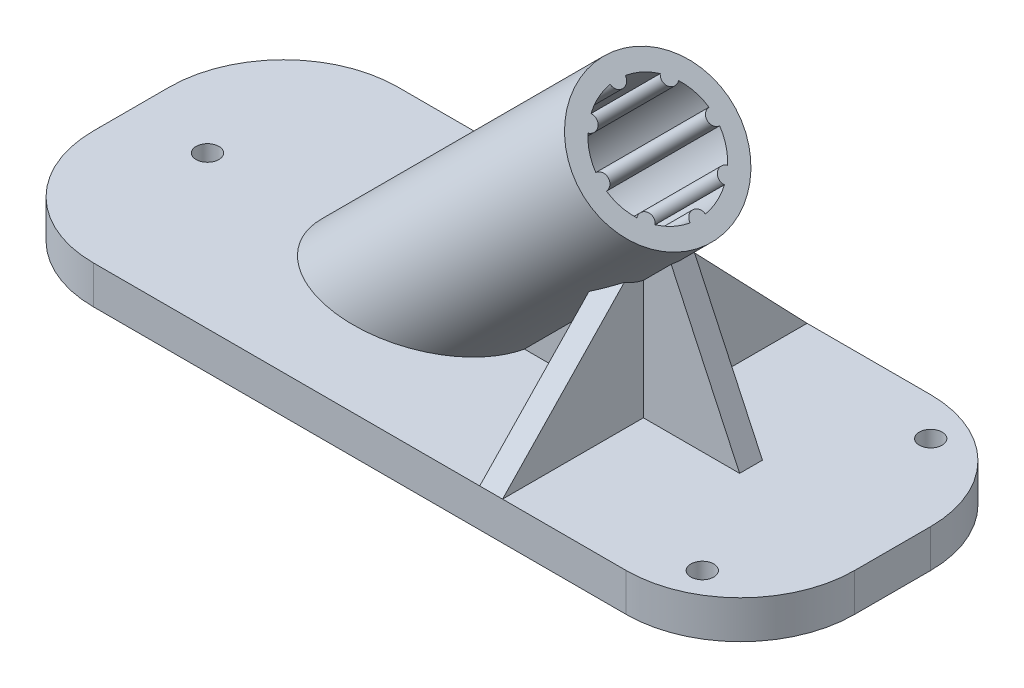
from build123d import *
from build123d.topology import SkipClean

# Parameters (mm, degrees)
BOSS_EXTRUDE1_DEPTH = 5
SKETCH3_W           = 36.405926788
SKETCH3_H           = 27.783470444
CUT_EXTRUDE1_DEPTH  = 36
CUT_EXTRUDE2_REACH  = 86.1
SKETCH4_R           = 7.5
BOSS_EXTRUDE2_REACH = 86.1
SKETCH5_R           = 1
RIB2_REACH          = 70.337
SKETCH6_WALL_W      = 155.225095754
SKETCH6_WALL_H      = 3
RIB3_REACH          = 83.817
SKETCH7_WALL_W      = 192.357197592
SKETCH7_WALL_H      = 3
RIB4_REACH          = 83.817
SKETCH9_WALL_W      = 192.357197592
SKETCH9_WALL_H      = 3
SKETCH10_R          = 1.5
CUT_EXTRUDE3_DEPTH  = 5


with BuildPart() as part:
    # Sketch1 → Boss-Extrude1 (new body)
    with BuildSketch(Plane(origin=(0, 0, 0), x_dir=(1, 0, 0), z_dir=(0, 1, 0))):
        with BuildLine():
            Line((35, 20), (-35, 20))
            ThreePointArc((-35, 20), (-45.606601718, 15.606601718), (-50, 5))
            Line((-50, 5), (-50, -5))
            ThreePointArc((-50, -5), (-45.606601718, -15.606601718), (-35, -20))
            Line((-35, -20), (35, -20))
            ThreePointArc((35, -20), (45.606601718, -15.606601718), (50, -5))
            Line((50, -5), (50, 5))
            ThreePointArc((50, 5), (45.606601718, 15.606601718), (35, 20))
        make_face()
    extrude(amount=BOSS_EXTRUDE1_DEPTH)

    # Sketch2 → Revolve2 (revolve)
    with SkipClean():  # the faces are left unmerged after this step: merging them gives an invalid solid
        with BuildSketch(Plane.XY, mode=Mode.PRIVATE) as revolve2_sk:
            Polygon((-30, 0), (12.071067812, 42.071067812), (19.142135624, 35), (-15.857864376, 0), align=None)
        revolve(revolve2_sk.sketch.rotate(Axis((19.142135624, 35, 0), (-0.7071067811865515, -0.7071067811865436, 0)), 180), axis=Axis((19.142135624, 35, 0), (-0.7071067811865515, -0.7071067811865436, 0)))

    # Sketch3 → Cut-Extrude1 (cut)
    with BuildSketch(Plane.XZ):
        with Locations((-14.157860418, 0)):
            Rectangle(SKETCH3_W, SKETCH3_H)
    extrude(amount=CUT_EXTRUDE1_DEPTH, mode=Mode.SUBTRACT)

    # Cut-Extrude2: up to this plane
    cut_extrude2_end = Plane(origin=(-35, 5, -5), z_dir=(0, 1, 0))
    # Sketch4 → Cut-Extrude2 (cut, up to the surface)
    with BuildSketch(Plane(origin=(27.071067812, 27.071067812, 0), x_dir=(0, 0, -1), z_dir=(0.7071067811865513, 0.7071067811865438, 0)), mode=Mode.PRIVATE) as cut_extrude2_sk1:
        with Locations(Location((0, 11.213203436, 0), (0, 0, 90))):
            Circle(SKETCH4_R)
    cut_extrude2_tool1 = split(extrude(cut_extrude2_sk1.sketch, amount=-CUT_EXTRUDE2_REACH, mode=Mode.PRIVATE), bisect_by=cut_extrude2_end, keep=Keep.BOTH, mode=Mode.PRIVATE)
    add(cut_extrude2_tool1.solids().sort_by_distance((19.142136, 35, 0))[0], mode=Mode.SUBTRACT)

    # Boss-Extrude2: up to this plane
    boss_extrude2_end = Plane(origin=(-35, 5, -5), z_dir=(0, 1, 0))
    # Sketch5 → Boss-Extrude2 (add, up to the surface)
    with BuildSketch(Plane(origin=(27.071067812, 27.071067812, 0), x_dir=(0, 0, -1), z_dir=(0.7071067811865513, 0.7071067811865438, 0)), mode=Mode.PRIVATE) as boss_extrude2_sk1:
        with Locations((7.5, 11.213203436)):
            Circle(SKETCH5_R)
    boss_extrude2_tool1 = split(extrude(boss_extrude2_sk1.sketch, amount=-BOSS_EXTRUDE2_REACH, mode=Mode.PRIVATE), bisect_by=boss_extrude2_end, keep=Keep.BOTH, mode=Mode.PRIVATE)
    add(boss_extrude2_tool1.solids().sort_by_distance((19.142136, 35, -7.5))[0])
    # Sketch5 → Boss-Extrude2 (add, up to the surface)
    with BuildSketch(Plane(origin=(27.071067812, 27.071067812, 0), x_dir=(0, 0, -1), z_dir=(0.7071067811865513, 0.7071067811865438, 0)), mode=Mode.PRIVATE) as boss_extrude2_sk2:
        with Locations((5.303300859, 5.909902577)):
            Circle(SKETCH5_R)
    boss_extrude2_tool2 = split(extrude(boss_extrude2_sk2.sketch, amount=-BOSS_EXTRUDE2_REACH, mode=Mode.PRIVATE), bisect_by=boss_extrude2_end, keep=Keep.BOTH, mode=Mode.PRIVATE)
    add(boss_extrude2_tool2.solids().sort_by_distance((22.892136, 31.25, -5.303301))[0])
    # Sketch5 → Boss-Extrude2 (add, up to the surface)
    with BuildSketch(Plane(origin=(27.071067812, 27.071067812, 0), x_dir=(0, 0, -1), z_dir=(0.7071067811865513, 0.7071067811865438, 0)), mode=Mode.PRIVATE) as boss_extrude2_sk3:
        with Locations((0, 3.713203436)):
            Circle(SKETCH5_R)
    boss_extrude2_tool3 = split(extrude(boss_extrude2_sk3.sketch, amount=-BOSS_EXTRUDE2_REACH, mode=Mode.PRIVATE), bisect_by=boss_extrude2_end, keep=Keep.BOTH, mode=Mode.PRIVATE)
    add(boss_extrude2_tool3.solids().sort_by_distance((24.445436, 29.696699, 0))[0])
    # Sketch5 → Boss-Extrude2 (add, up to the surface)
    with BuildSketch(Plane(origin=(27.071067812, 27.071067812, 0), x_dir=(0, 0, -1), z_dir=(0.7071067811865513, 0.7071067811865438, 0)), mode=Mode.PRIVATE) as boss_extrude2_sk4:
        with Locations((-5.303300859, 5.909902577)):
            Circle(SKETCH5_R)
    boss_extrude2_tool4 = split(extrude(boss_extrude2_sk4.sketch, amount=-BOSS_EXTRUDE2_REACH, mode=Mode.PRIVATE), bisect_by=boss_extrude2_end, keep=Keep.BOTH, mode=Mode.PRIVATE)
    add(boss_extrude2_tool4.solids().sort_by_distance((22.892136, 31.25, 5.303301))[0])
    # Sketch5 → Boss-Extrude2 (add, up to the surface)
    with BuildSketch(Plane(origin=(27.071067812, 27.071067812, 0), x_dir=(0, 0, -1), z_dir=(0.7071067811865513, 0.7071067811865438, 0)), mode=Mode.PRIVATE) as boss_extrude2_sk5:
        with Locations((-7.5, 11.213203436)):
            Circle(SKETCH5_R)
    boss_extrude2_tool5 = split(extrude(boss_extrude2_sk5.sketch, amount=-BOSS_EXTRUDE2_REACH, mode=Mode.PRIVATE), bisect_by=boss_extrude2_end, keep=Keep.BOTH, mode=Mode.PRIVATE)
    add(boss_extrude2_tool5.solids().sort_by_distance((19.142136, 35, 7.5))[0])
    # Sketch5 → Boss-Extrude2 (add, up to the surface)
    with BuildSketch(Plane(origin=(27.071067812, 27.071067812, 0), x_dir=(0, 0, -1), z_dir=(0.7071067811865513, 0.7071067811865438, 0)), mode=Mode.PRIVATE) as boss_extrude2_sk6:
        with Locations((-5.303300859, 16.516504294)):
            Circle(SKETCH5_R)
    boss_extrude2_tool6 = split(extrude(boss_extrude2_sk6.sketch, amount=-BOSS_EXTRUDE2_REACH, mode=Mode.PRIVATE), bisect_by=boss_extrude2_end, keep=Keep.BOTH, mode=Mode.PRIVATE)
    add(boss_extrude2_tool6.solids().sort_by_distance((15.392136, 38.75, 5.303301))[0])
    # Sketch5 → Boss-Extrude2 (add, up to the surface)
    with BuildSketch(Plane(origin=(27.071067812, 27.071067812, 0), x_dir=(0, 0, -1), z_dir=(0.7071067811865513, 0.7071067811865438, 0)), mode=Mode.PRIVATE) as boss_extrude2_sk7:
        with Locations((0, 18.713203436)):
            Circle(SKETCH5_R)
    boss_extrude2_tool7 = split(extrude(boss_extrude2_sk7.sketch, amount=-BOSS_EXTRUDE2_REACH, mode=Mode.PRIVATE), bisect_by=boss_extrude2_end, keep=Keep.BOTH, mode=Mode.PRIVATE)
    add(boss_extrude2_tool7.solids().sort_by_distance((13.838835, 40.303301, 0))[0])
    # Sketch5 → Boss-Extrude2 (add, up to the surface)
    with BuildSketch(Plane(origin=(27.071067812, 27.071067812, 0), x_dir=(0, 0, -1), z_dir=(0.7071067811865513, 0.7071067811865438, 0)), mode=Mode.PRIVATE) as boss_extrude2_sk8:
        with Locations((5.303300859, 16.516504294)):
            Circle(SKETCH5_R)
    boss_extrude2_tool8 = split(extrude(boss_extrude2_sk8.sketch, amount=-BOSS_EXTRUDE2_REACH, mode=Mode.PRIVATE), bisect_by=boss_extrude2_end, keep=Keep.BOTH, mode=Mode.PRIVATE)
    add(boss_extrude2_tool8.solids().sort_by_distance((15.392136, 38.75, -5.303301))[0])

    # Sketch6 wall → Rib2 (add, up to next)
    with BuildSketch(Plane(origin=(26.502692564, 15.5, 0), x_dir=(0.422618261725, -0.906307787044, 0), z_dir=(0.906307787044, 0.422618261725, 0)), mode=Mode.PRIVATE) as rib2_sk1:
        Rectangle(SKETCH6_WALL_W, SKETCH6_WALL_H)
    rib2_tool1 = extrude(rib2_sk1.sketch, amount=-RIB2_REACH, mode=Mode.PRIVATE) - part.part
    add(rib2_tool1.solids().sort_by_distance((26.502692564, 15.5, 0))[0])

    # Sketch7 wall → Rib3 (add, up to next)
    with BuildSketch(Plane(origin=(17.261595026, 14.641447257, 10.75), x_dir=(0, -0.721603754863, 0.69230630574), z_dir=(0, -0.69230630574, -0.721603754863)), mode=Mode.PRIVATE) as rib3_sk1:
        Rectangle(SKETCH7_WALL_W, SKETCH7_WALL_H)
    rib3_tool1 = extrude(rib3_sk1.sketch, amount=RIB3_REACH, mode=Mode.PRIVATE) - part.part
    add(rib3_tool1.solids().sort_by_distance((17.261595026, 14.641447257, 10.75))[0])

    # Sketch9 wall → Rib4 (add, up to next)
    with BuildSketch(Plane(origin=(17.261595026, 14.641447257, -10.75), x_dir=(0, -0.721603754863, -0.69230630574), z_dir=(0, 0.69230630574, -0.721603754863)), mode=Mode.PRIVATE) as rib4_sk1:
        Rectangle(SKETCH9_WALL_W, SKETCH9_WALL_H)
    rib4_tool1 = extrude(rib4_sk1.sketch, amount=-RIB4_REACH, mode=Mode.PRIVATE) - part.part
    add(rib4_tool1.solids().sort_by_distance((17.261595026, 14.641447257, -10.75))[0])

    # Sketch10 → Cut-Extrude3 (cut)
    with BuildSketch(Plane.XZ):
        with Locations(Location((-40, 0, 0), (0, 0, 270))):
            Circle(SKETCH10_R)
        with Locations(Location((40, 15, 0), (0, 0, 270))):
            Circle(SKETCH10_R)
        with Locations(Location((40, -15, 0), (0, 0, 270))):
            Circle(SKETCH10_R)
    extrude(amount=-CUT_EXTRUDE3_DEPTH, mode=Mode.SUBTRACT)


solid = part.part
